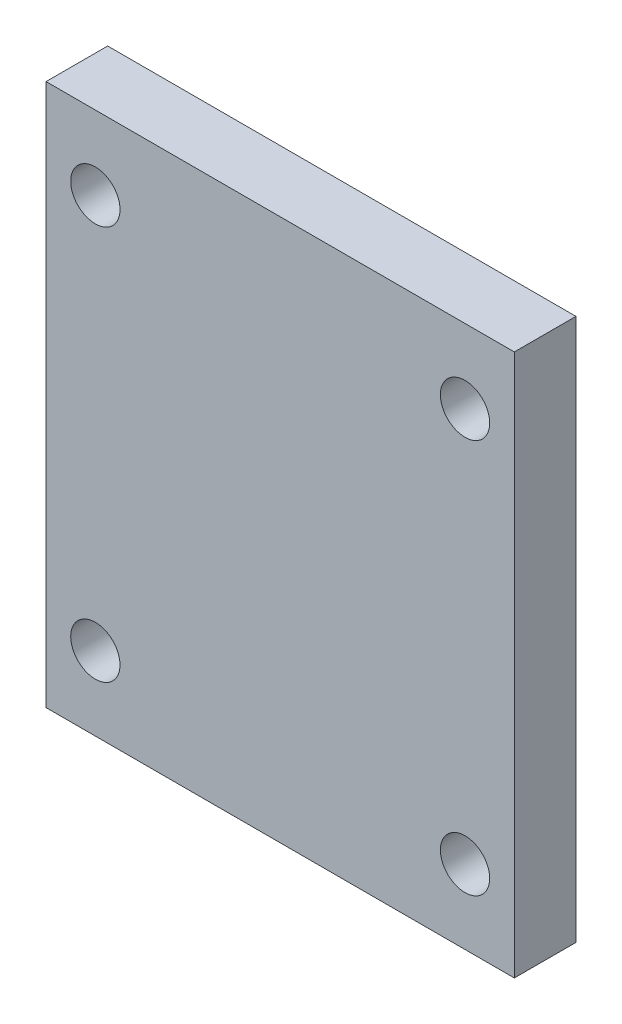
from build123d import *

# Parameters (mm, degrees)
SKETCH1_W           = 38
SKETCH1_H           = 44
SKETCH1_R           = 2
BOSS_EXTRUDE1_DEPTH = 2.5


with BuildPart() as part:
    # Sketch1 → Boss-Extrude1 (new, symmetric)
    with BuildSketch(Plane.XY):
        Rectangle(SKETCH1_W, SKETCH1_H)
        with Locations((-15, 16)):
            Circle(SKETCH1_R, mode=Mode.SUBTRACT)
        with Locations(Location((-15, -16, 0), (0, 0, 180))):
            Circle(SKETCH1_R, mode=Mode.SUBTRACT)
        with Locations((15, -16)):
            Circle(SKETCH1_R, mode=Mode.SUBTRACT)
        with Locations(Location((15, 16, 0), (0, 0, 180))):
            Circle(SKETCH1_R, mode=Mode.SUBTRACT)
    extrude(amount=BOSS_EXTRUDE1_DEPTH, both=True)


solid = part.part
